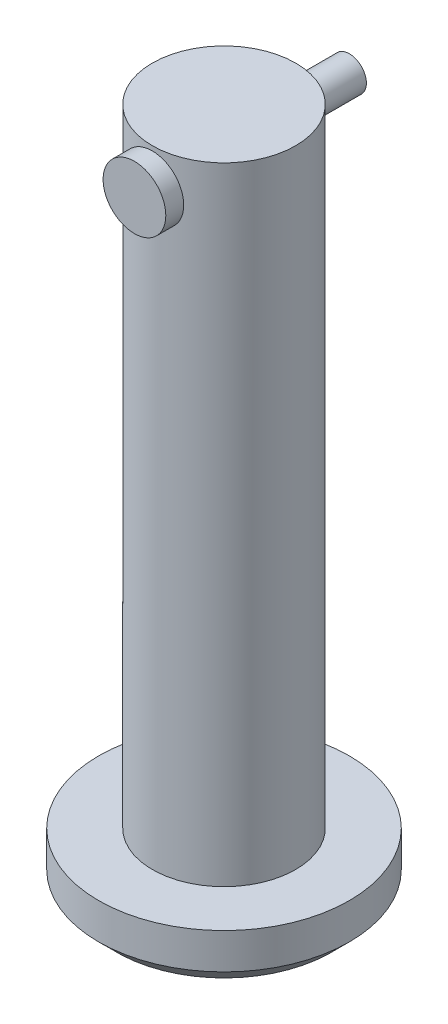
from build123d import *

# Parameters (mm, degrees)
SKETCH1_R                = 4
BOSS_EXTRUDE1_DEPTH      = 35
SKETCH2_R                = 7
BOSS_EXTRUDE2_DEPTH      = 3
CHAMFER1_SIZE            = 1
CUT_EXTRUDE1_DEPTH       = 10
CUT_EXTRUDE1_DEPTH_BACK  = 10
SKETCH3_R                = 1
BOSS_EXTRUDE3_DEPTH      = 5
BOSS_EXTRUDE3_DEPTH_BACK = 7
SKETCH4_R                = 0.95
SKETCH5_R                = 1.75
BOSS_EXTRUDE4_DEPTH      = 1


with BuildPart() as part:
    # Sketch1 → Boss-Extrude1 (new body)
    with BuildSketch(Plane(origin=(0, 0, 0), x_dir=(1, 0, 0), z_dir=(0, 1, 0))):
        Circle(SKETCH1_R)
    extrude(amount=BOSS_EXTRUDE1_DEPTH)

    # Sketch2 → Boss-Extrude2 (add)
    with BuildSketch(Plane.XZ):
        Circle(SKETCH2_R)
    extrude(amount=BOSS_EXTRUDE2_DEPTH)

    # Chamfer1
    chamfer1_edges = [part.edges().sort_by_distance(p)[0] for p in [
        (-7, -3, 0),
    ]]
    chamfer(chamfer1_edges, length=CHAMFER1_SIZE)

    # Sketch3 → Cut-Extrude1 (cut, two sides: drawn at the far end of the back side and taken through both)
    with BuildSketch(Plane.XY.offset(-CUT_EXTRUDE1_DEPTH_BACK)):
        with Locations((0, 33)):
            Circle(SKETCH3_R)
    extrude(amount=CUT_EXTRUDE1_DEPTH + CUT_EXTRUDE1_DEPTH_BACK, mode=Mode.SUBTRACT)


with BuildPart() as body_2:
    # Sketch4 → Boss-Extrude3 (new, two sides: drawn at the far end of the back side and taken through both)
    with BuildSketch(Plane.XY.offset(-BOSS_EXTRUDE3_DEPTH_BACK)):
        with Locations((0, 33)):
            Circle(SKETCH4_R)
    extrude(amount=BOSS_EXTRUDE3_DEPTH + BOSS_EXTRUDE3_DEPTH_BACK)

    # Sketch5 → Boss-Extrude4 (add)
    with BuildSketch(Plane.XY.offset(5)):
        with Locations((0, 33)):
            Circle(SKETCH5_R)
    extrude(amount=-BOSS_EXTRUDE4_DEPTH)


solid = Compound([part.part, body_2.part])
